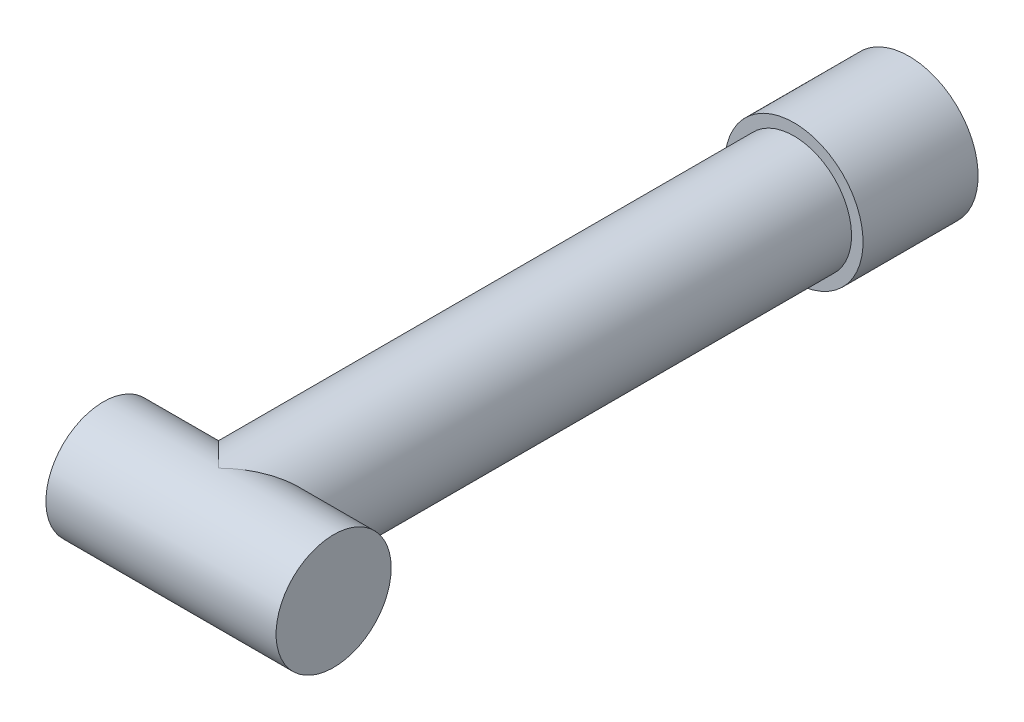
from build123d import *

# Parameters (mm, degrees)
SKETCH1_R                = 2.5
BOSS_EXTRUDE1_DEPTH      = 30
BOSS_EXTRUDE2_DEPTH      = 5
BOSS_EXTRUDE2_DEPTH_BACK = 5
SKETCH2_R                = 2.5
SKETCH3_R                = 3
BOSS_EXTRUDE3_DEPTH      = 5


with BuildPart() as part:
    # Sketch1 → Boss-Extrude1 (new body)
    with BuildSketch(Plane.XY):
        Circle(SKETCH1_R)
    extrude(amount=-BOSS_EXTRUDE1_DEPTH)

    # Sketch2 → Boss-Extrude2 (add, two sides: drawn at the far end of the back side and taken through both)
    with BuildSketch(Plane(origin=(0, 0, 0), x_dir=(0, 0, -1), z_dir=(1, 0, 0)).offset(-BOSS_EXTRUDE2_DEPTH_BACK)):
        Circle(SKETCH2_R)
    extrude(amount=BOSS_EXTRUDE2_DEPTH + BOSS_EXTRUDE2_DEPTH_BACK)

    # Sketch3 → Boss-Extrude3 (add)
    with BuildSketch(Plane(origin=(0, 0, -30), x_dir=(-1, 0, 0), z_dir=(0, 0, -1))):
        Circle(SKETCH3_R)
    extrude(amount=-BOSS_EXTRUDE3_DEPTH)


solid = part.part
